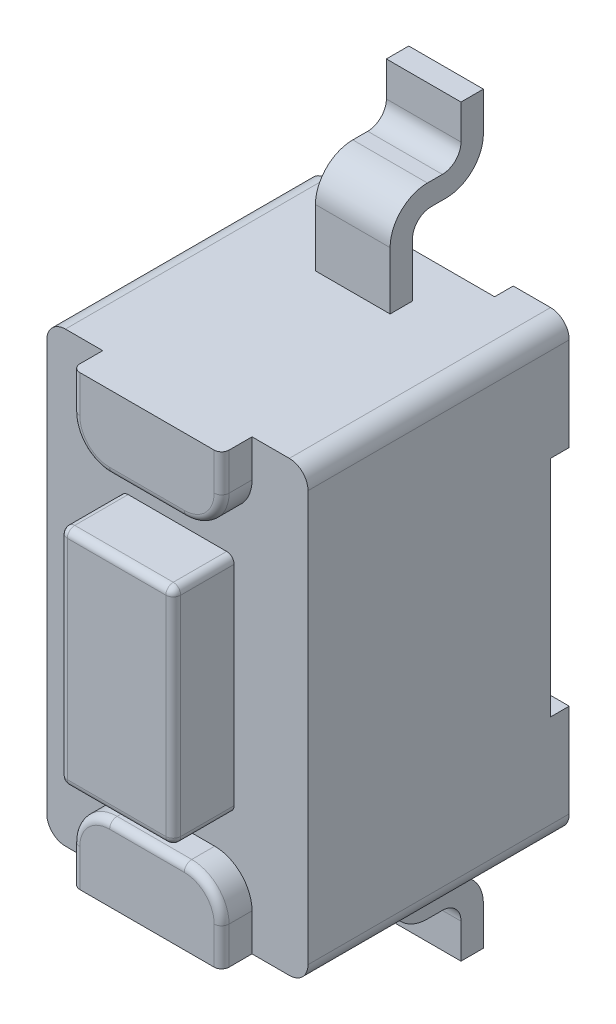
from build123d import *

# Parameters (mm, degrees)
SKETCH1_W            = 3.5
SKETCH1_H            = 6
BOSS_EXTRUDE1_DEPTH  = 3.25
SKETCH2_W            = 1
SKETCH2_H            = 0.3
BOSS_EXTRUDE2_DEPTH  = 1.9845
SKETCH3_W            = 1
SKETCH3_H            = 1.0145
BOSS_EXTRUDE3_DEPTH  = 0.95
SKETCH4_W            = 1
SKETCH4_H            = 0.3
BOSS_EXTRUDE4_DEPTH  = 1.9845
SKETCH5_W            = 1
SKETCH5_H            = 1.0145
BOSS_EXTRUDE5_DEPTH  = 0.95
SKETCH6_W            = 0.95
SKETCH6_H            = 0.7145
CUT_EXTRUDE1_DEPTH   = 8.028510884
SKETCH7_W            = 0.95
SKETCH7_H            = 0.7145
CUT_EXTRUDE2_DEPTH   = 8.028510884
SKETCH8_W            = 0.75
SKETCH8_H            = 1.5
BOSS_EXTRUDE6_DEPTH  = 0.25
SKETCH9_W            = 0.75
SKETCH9_H            = 1.5
BOSS_EXTRUDE7_DEPTH  = 0.25
SKETCH10_W           = 0.75
SKETCH10_H           = 1.5
BOSS_EXTRUDE8_DEPTH  = 0.25
SKETCH11_W           = 0.75
SKETCH11_H           = 1.5
BOSS_EXTRUDE9_DEPTH  = 0.25
SKETCH12_W           = 2
SKETCH12_H           = 1
BOSS_EXTRUDE10_DEPTH = 0.4075
SKETCH13_W           = 2
SKETCH13_H           = 1
BOSS_EXTRUDE11_DEPTH = 0.4075
SKETCH14_W           = 1.52
SKETCH14_H           = 3
BOSS_EXTRUDE12_DEPTH = 0.815
FILLET1_R            = 0.5
FILLET2_R            = 0.1
FILLET3_R            = 0.25


with BuildPart() as part:
    # Sketch1 → Boss-Extrude1 (new body)
    with BuildSketch(Plane(origin=(0, 0, -4.065), x_dir=(-1, 0, 0), z_dir=(0, 0, -1))):
        Rectangle(SKETCH1_W, SKETCH1_H)
    extrude(amount=-BOSS_EXTRUDE1_DEPTH)

    # Sketch2 → Boss-Extrude2 (add)
    with BuildSketch(Plane(origin=(0, 3, 0), x_dir=(-1, 0, 0), z_dir=(0, 1, 0))):
        with Locations((0, -3.315)):
            Rectangle(SKETCH2_W, SKETCH2_H)
    extrude(amount=BOSS_EXTRUDE2_DEPTH)

    # Sketch3 → Boss-Extrude3 (add)
    with BuildSketch(Plane(origin=(0, 0, -3.465), x_dir=(-1, 0, 0), z_dir=(0, 0, -1))):
        with Locations((0, 4.47725)):
            Rectangle(SKETCH3_W, SKETCH3_H)
    extrude(amount=BOSS_EXTRUDE3_DEPTH)

    # Sketch4 → Boss-Extrude4 (add)
    with BuildSketch(Plane.XZ.offset(3)):
        with Locations((0, -3.315)):
            Rectangle(SKETCH4_W, SKETCH4_H)
    extrude(amount=BOSS_EXTRUDE4_DEPTH)

    # Sketch5 → Boss-Extrude5 (add)
    with BuildSketch(Plane(origin=(0, 0, -3.465), x_dir=(-1, 0, 0), z_dir=(0, 0, -1))):
        with Locations((0, -4.47725)):
            Rectangle(SKETCH5_W, SKETCH5_H)
    extrude(amount=BOSS_EXTRUDE5_DEPTH)

    # Sketch6 → Cut-Extrude1 (cut, through all)
    with BuildSketch(Plane(origin=(0.5, 0, 0), x_dir=(0, 0, -1), z_dir=(1, 0, 0))):
        with Locations((3.64, 4.62725)):
            Rectangle(SKETCH6_W, SKETCH6_H)
    extrude(amount=-CUT_EXTRUDE1_DEPTH, mode=Mode.SUBTRACT)

    # Sketch7 → Cut-Extrude2 (cut, through all)
    with BuildSketch(Plane(origin=(0.5, 0, 0), x_dir=(0, 0, -1), z_dir=(1, 0, 0))):
        with Locations((3.64, -4.62725)):
            Rectangle(SKETCH7_W, SKETCH7_H)
    extrude(amount=-CUT_EXTRUDE2_DEPTH, mode=Mode.SUBTRACT)

    # Sketch8 → Boss-Extrude6 (add)
    with BuildSketch(Plane(origin=(0, 0, -4.065), x_dir=(-1, 0, 0), z_dir=(0, 0, -1))):
        with Locations((-1.375, 2.25)):
            Rectangle(SKETCH8_W, SKETCH8_H)
    extrude(amount=BOSS_EXTRUDE6_DEPTH)

    # Sketch9 → Boss-Extrude7 (add)
    with BuildSketch(Plane(origin=(0, 0, -4.065), x_dir=(-1, 0, 0), z_dir=(0, 0, -1))):
        with Locations((-1.375, -2.25)):
            Rectangle(SKETCH9_W, SKETCH9_H)
    extrude(amount=BOSS_EXTRUDE7_DEPTH)

    # Sketch10 → Boss-Extrude8 (add)
    with BuildSketch(Plane(origin=(0, 0, -4.065), x_dir=(-1, 0, 0), z_dir=(0, 0, -1))):
        with Locations((1.375, 2.25)):
            Rectangle(SKETCH10_W, SKETCH10_H)
    extrude(amount=BOSS_EXTRUDE8_DEPTH)

    # Sketch11 → Boss-Extrude9 (add)
    with BuildSketch(Plane(origin=(0, 0, -4.065), x_dir=(-1, 0, 0), z_dir=(0, 0, -1))):
        with Locations((1.375, -2.25)):
            Rectangle(SKETCH11_W, SKETCH11_H)
    extrude(amount=BOSS_EXTRUDE9_DEPTH)

    # Sketch12 → Boss-Extrude10 (add)
    with BuildSketch(Plane.XY.offset(-0.815)):
        with Locations((0, -2.5)):
            Rectangle(SKETCH12_W, SKETCH12_H)
    extrude(amount=BOSS_EXTRUDE10_DEPTH)

    # Sketch13 → Boss-Extrude11 (add)
    with BuildSketch(Plane.XY.offset(-0.815)):
        with Locations((0, 2.5)):
            Rectangle(SKETCH13_W, SKETCH13_H)
    extrude(amount=BOSS_EXTRUDE11_DEPTH)

    # Sketch14 → Boss-Extrude12 (add)
    with BuildSketch(Plane.XY.offset(-0.815)):
        Rectangle(SKETCH14_W, SKETCH14_H)
    extrude(amount=BOSS_EXTRUDE12_DEPTH)

    # Fillet1
    fillet1_edges = [part.edges().sort_by_distance(p)[0] for p in [
        (0, 3.97, -4.415),
        (0, 4.27, -3.165),
        (0, -4.27, -3.165),
        (0, -3.97, -4.415),
        (-1, 2, -0.61125),
        (1, -2, -0.61125),
        (-1, -2, -0.61125),
        (1, 2, -0.61125),
    ]]
    fillet(fillet1_edges, radius=FILLET1_R)

    # Fillet2
    fillet2_edges = [part.edges().sort_by_distance(p)[0] for p in [
        (-0.76, -1.5, -0.4075),
        (0.76, -1.5, -0.4075),
        (0, -1.5, 0),
        (-0.76, 0, 0),
        (-0.76, 1.5, -0.4075),
        (0.76, 0, 0),
        (0, 1.5, 0),
        (0.76, 1.5, -0.4075),
        (-1, 2.75, -0.4075),
        (-0.853553391, 2.146446609, -0.4075),
        (0, 2, -0.4075),
        (0.853553391, 2.146446609, -0.4075),
        (1, 2.75, -0.4075),
        (1, -2.75, -0.4075),
        (0.853553391, -2.146446609, -0.4075),
        (0, -2, -0.4075),
        (-1, -2.75, -0.4075),
        (-0.853553391, -2.146446609, -0.4075),
    ]]
    fillet(fillet2_edges, radius=FILLET2_R)

    # Fillet3
    fillet3_edges = [part.edges().sort_by_distance(p)[0] for p in [
        (0, -4.27, -4.115),
        (-1.75, -3, -2.565),
        (-1.75, 3, -2.565),
        (1.75, -3, -2.565),
        (1.75, 3, -2.565),
        (0, 4.27, -4.115),
        (0, -3.97, -3.465),
        (0, 3.97, -3.465),
    ]]
    fillet(fillet3_edges, radius=FILLET3_R)


solid = part.part
